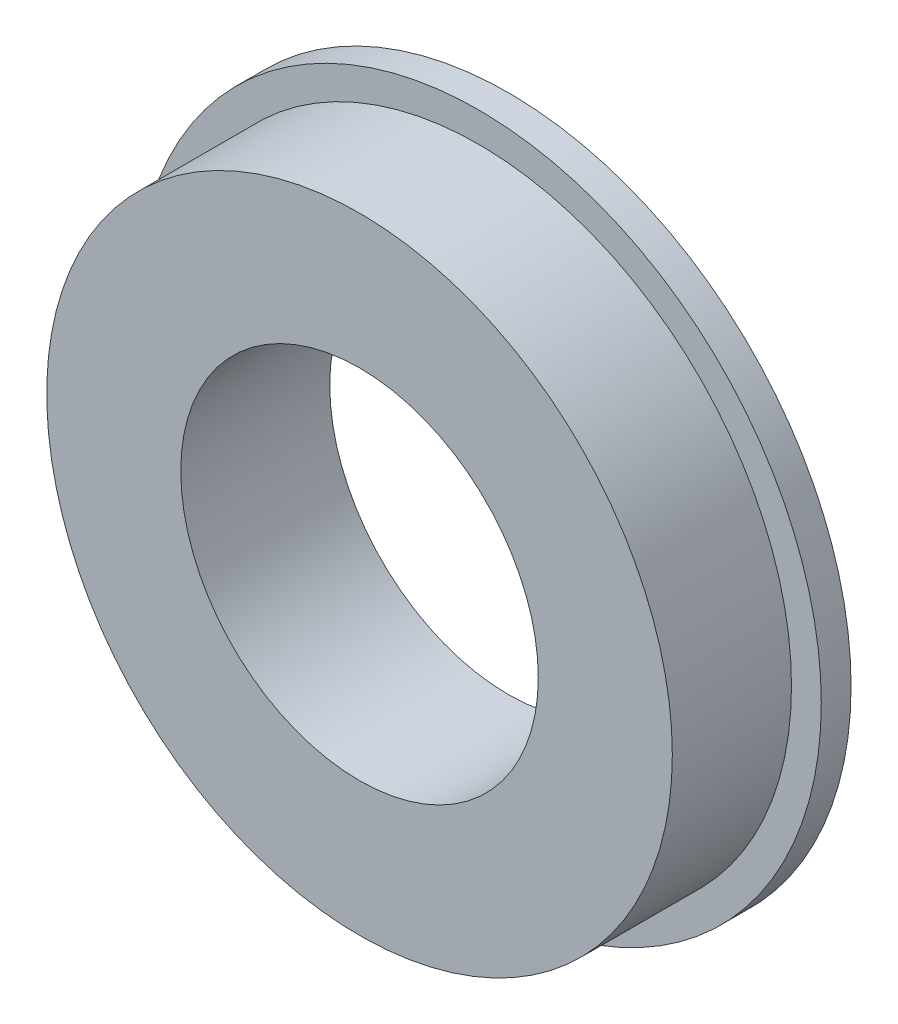
from build123d import *

# Parameters (mm, degrees)
SKETCH_1_R          = 11.5
EXTRUDE_1_DEPTH     = 1
SKETCH_2_R          = 10.5
EXTRUDE_2_DEPTH     = 4
SKETCH_3_R          = 6
CUT_EXTRUDE_1_DEPTH = 18.014699527


with BuildPart() as part:
    # 草图1 → 凸台-拉伸1 (new body)
    with BuildSketch(Plane.XY):
        Circle(SKETCH_1_R)
    extrude(amount=EXTRUDE_1_DEPTH)

    # 草图2 → 凸台-拉伸2 (add)
    with BuildSketch(Plane.XY.offset(1)):
        Circle(SKETCH_2_R)
    extrude(amount=EXTRUDE_2_DEPTH)

    # 草图3 → 切除-拉伸1 (cut, through all)
    with BuildSketch(Plane.XY.offset(5)):
        Circle(SKETCH_3_R)
    extrude(amount=-CUT_EXTRUDE_1_DEPTH, mode=Mode.SUBTRACT)


solid = part.part
